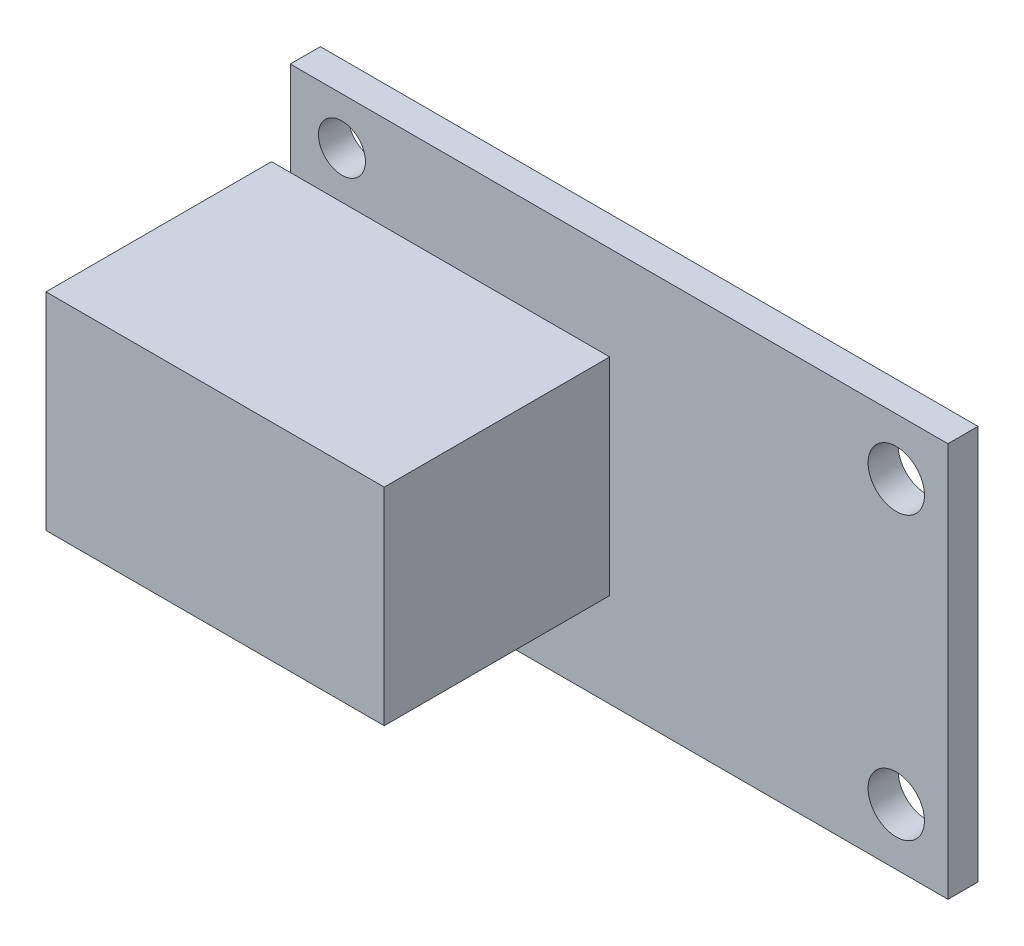
from build123d import *

# Parameters (mm, degrees)
SKETCH_1_W             = 35
SKETCH_1_H             = 21
EXTRUDE_346_DEPTH      = 1.6
SKETCH_2_W             = 18
SKETCH_2_H             = 11
RJ_9_DEPTH             = 12
SKETCH_3_R             = 1.25
SKETCH_3_R_2           = 1.5
CUT_EXTRUDE_1000_DEPTH = 25.423349484


with BuildPart() as part:
    # Эскиз1 → Extrude 346 (new body)
    with BuildSketch(Plane.XY):
        Rectangle(SKETCH_1_W, SKETCH_1_H)
    extrude(amount=EXTRUDE_346_DEPTH)

    # Эскиз2 → RJ-9 (add)
    with BuildSketch(Plane.XY.offset(1.6)):
        with Locations((-9.5, 0)):
            Rectangle(SKETCH_2_W, SKETCH_2_H)
    extrude(amount=RJ_9_DEPTH)

    # Эскиз3 → Cut-Extrude 1000 (cut, through all)
    with BuildSketch(Plane.XY.offset(1.6)):
        with Locations((-14.75, 8)):
            Circle(SKETCH_3_R)
        with Locations((14.75, 7.5)):
            Circle(SKETCH_3_R_2)
        with Locations(Location((14.75, -7.5, 0), (0, 0, 180))):
            Circle(SKETCH_3_R_2)
        with Locations(Location((-14.75, -8, 0), (0, 0, 180))):
            Circle(SKETCH_3_R)
    extrude(amount=-CUT_EXTRUDE_1000_DEPTH, mode=Mode.SUBTRACT)


solid = part.part
